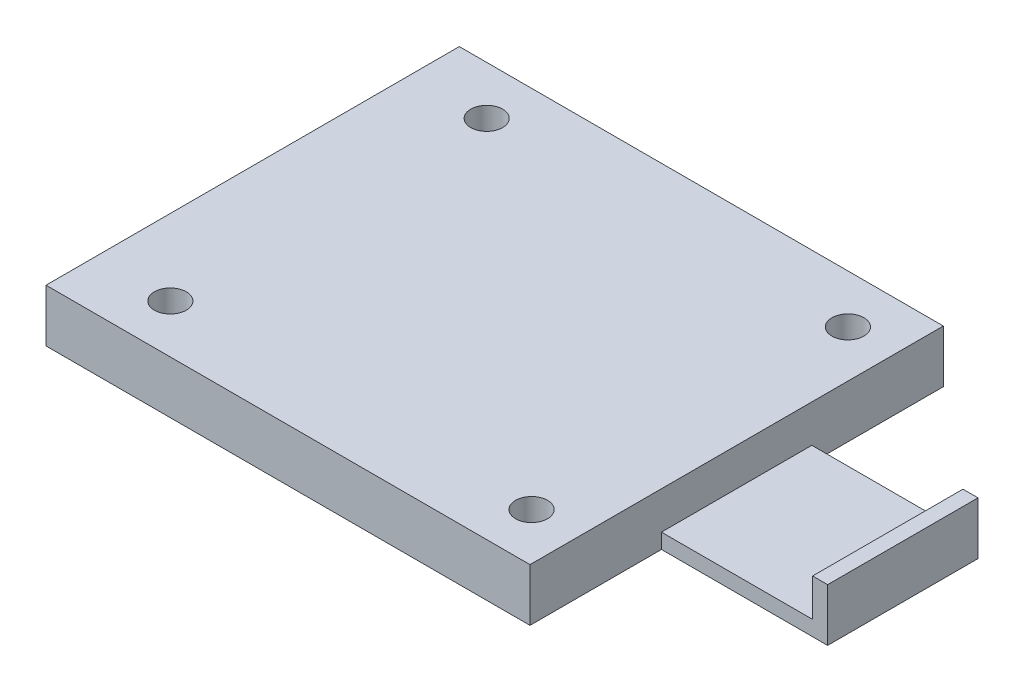
from build123d import *

# Parameters (mm, degrees)
SKETCH1_W             = 64.370548606
SKETCH1_H             = 54.967832462
SKETCH1_R             = 2.125
BOSS_EXTRUDE1_DEPTH   = 7
SKETCH1_W_2           = 2
SKETCH1_H_2           = 20
BOSS_EXTRUDE1_2_DEPTH = 7
SKETCH1_3_W           = 20.1
SKETCH1_3_H           = 20
BOSS_EXTRUDE2_DEPTH   = 2


with BuildPart() as part:
    # Sketch1 → Boss-Extrude1 (new body)
    with BuildSketch(Plane(origin=(0, 0, 0), x_dir=(1, 0, 0), z_dir=(0, 1, 0))):
        Rectangle(SKETCH1_W, SKETCH1_H)
        with Locations((-22.09447199, -21.035)):
            Circle(SKETCH1_R, mode=Mode.SUBTRACT)
        with Locations((25.94552801, -21.035)):
            Circle(SKETCH1_R, mode=Mode.SUBTRACT)
        with Locations((-22.09447199, 21.035)):
            Circle(SKETCH1_R, mode=Mode.SUBTRACT)
        with Locations((25.94552801, 21.035)):
            Circle(SKETCH1_R, mode=Mode.SUBTRACT)
    extrude(amount=BOSS_EXTRUDE1_DEPTH)



with BuildPart() as body_2:
    # Sketch1 → Boss-Extrude1 2 (new body)
    with BuildSketch(Plane(origin=(0, 0, 0), x_dir=(1, 0, 0), z_dir=(0, 1, 0))):
        with Locations((53.285274303, 0)):
            Rectangle(SKETCH1_W_2, SKETCH1_H_2)
    extrude(amount=BOSS_EXTRUDE1_2_DEPTH)


with BuildPart() as part_1:
    add(part.part)

    add(body_2.part)  # Boss-Extrude2 merges body 2
    # Sketch1<3> → Boss-Extrude2 (add)
    with BuildSketch(Plane(origin=(0, 0, 0), x_dir=(1, 0, 0), z_dir=(0, 1, 0))):
        with Locations((42.235274303, 0)):
            Rectangle(SKETCH1_3_W, SKETCH1_3_H)
    extrude(amount=BOSS_EXTRUDE2_DEPTH)


solid = part_1.part
